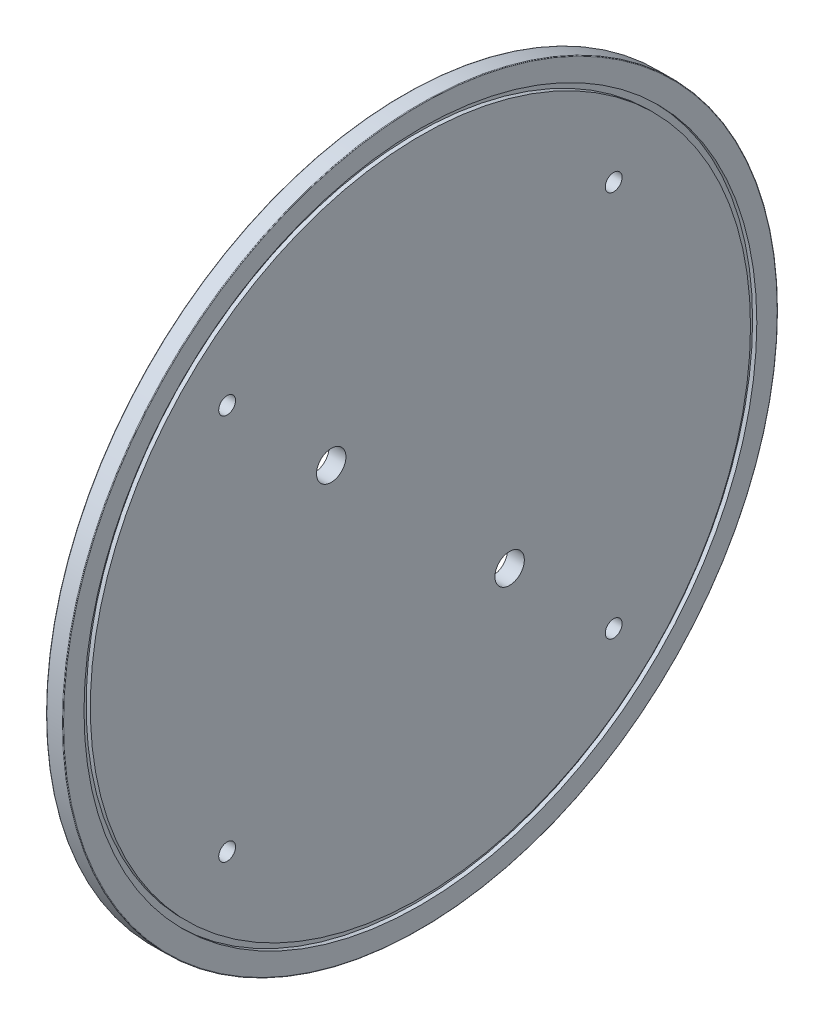
from build123d import *

# Parameters (mm, degrees)
SKETCH_1_R               = 170
EXTRUDE_1_DEPTH          = 8
SKETCH_5_R               = 4
CUT_EXTRUDE_4_DEPTH      = 10
PATTERN_CIRCULAR_3_COUNT = 4
SKETCH_7_R               = 160
SKETCH_7_R_2             = 157
CUT_EXTRUDE_5_DEPTH      = 2
FILLET_1_R               = 0.3
SKETCH_9_R               = 7
CUT_EXTRUDE_7_DEPTH      = 10
PATTERN_CIRCULAR_5_COUNT = 2


with BuildPart() as part:
    # 草图1 → 凸台-拉伸1 (new body)
    with BuildSketch(Plane(origin=(0, 0, 0), x_dir=(0, 0, -1), z_dir=(1, 0, 0))):
        Circle(SKETCH_1_R)
    extrude(amount=EXTRUDE_1_DEPTH)

    # 草图5 → 切除-拉伸4 (cut)
    with BuildSketch(Plane(origin=(8, 0, 0), x_dir=(0, 0, -1), z_dir=(1, 0, 0))):
        with Locations((-91.923881554, 91.923881554)):
            Circle(SKETCH_5_R)
    cut_extrude_4 = extrude(amount=-CUT_EXTRUDE_4_DEPTH, mode=Mode.SUBTRACT)

    # 阵列(圆周)3: 切除-拉伸4 ×4 about axis
    pattern_circular_3_axis = Axis((0, 0, 0), (1, 0, 0))
    for i in range(1, PATTERN_CIRCULAR_3_COUNT):
        add(cut_extrude_4.rotate(pattern_circular_3_axis, i * 360 / PATTERN_CIRCULAR_3_COUNT), mode=Mode.SUBTRACT)

    # 草图7 → 切除-拉伸5 (cut)
    with BuildSketch(Plane(origin=(8, 0, 0), x_dir=(0, 0, -1), z_dir=(1, 0, 0))):
        Circle(SKETCH_7_R)
        Circle(SKETCH_7_R_2, mode=Mode.SUBTRACT)
    extrude(amount=-CUT_EXTRUDE_5_DEPTH, mode=Mode.SUBTRACT)

    # 圆角1
    fillet_1_edges = [part.edges().sort_by_distance(p)[0] for p in [
        (0, 0, 170),
        (8, 0, 170),
    ]]
    fillet(fillet_1_edges, radius=FILLET_1_R)

    # 草图9 → 切除-拉伸7 (cut)
    with BuildSketch(Plane(origin=(8, 0, 0), x_dir=(0, 0, -1), z_dir=(1, 0, 0))):
        with Locations((42.426406871, -42.426406871)):
            Circle(SKETCH_9_R)
    cut_extrude_7 = extrude(amount=-CUT_EXTRUDE_7_DEPTH, mode=Mode.SUBTRACT)

    # 阵列(圆周)5: 切除-拉伸7 ×2 about axis
    pattern_circular_5_axis = Axis((0, 0, 0), (1, 0, 0))
    for i in range(1, PATTERN_CIRCULAR_5_COUNT):
        add(cut_extrude_7.rotate(pattern_circular_5_axis, i * 360 / PATTERN_CIRCULAR_5_COUNT), mode=Mode.SUBTRACT)


solid = part.part
